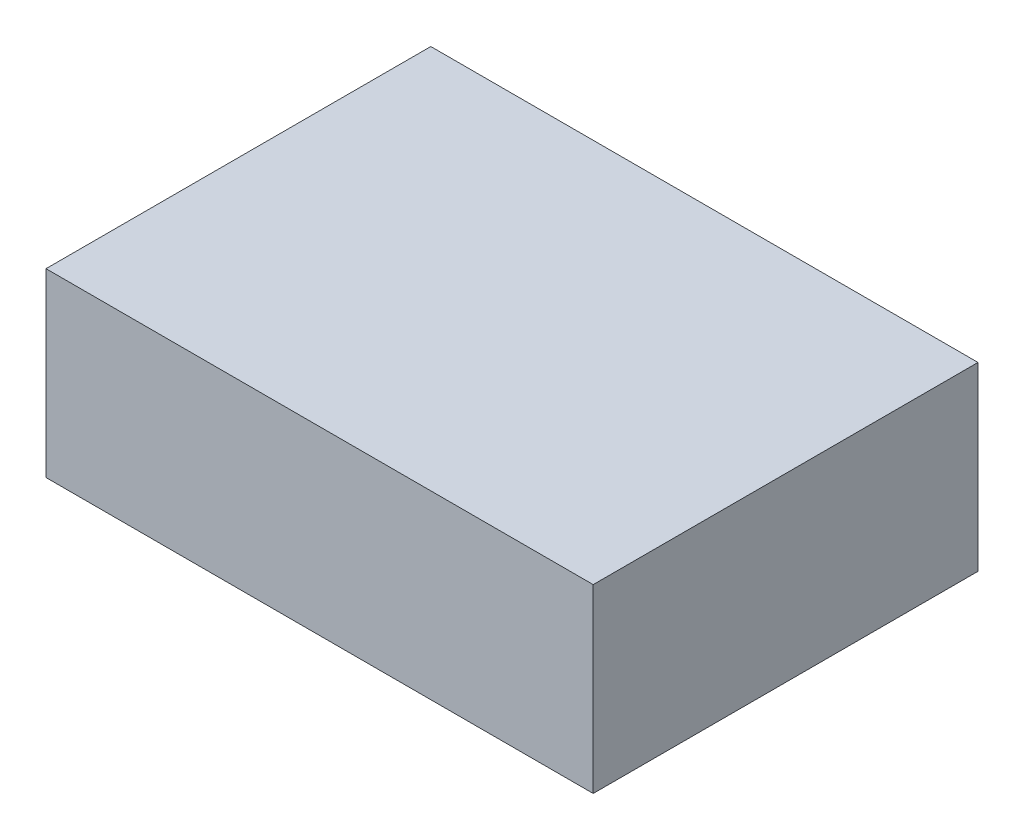
from build123d import *

# Parameters (mm, degrees)
SKETCH1_W           = 109.5
SKETCH1_H           = 77
BOSS_EXTRUDE1_DEPTH = 36.2


with BuildPart() as part:
    # Sketch1 → Boss-Extrude1 (new body)
    with BuildSketch(Plane(origin=(0, 0, 0), x_dir=(1, 0, 0), z_dir=(0, 1, 0))):
        Rectangle(SKETCH1_W, SKETCH1_H)
    extrude(amount=BOSS_EXTRUDE1_DEPTH)


solid = part.part
